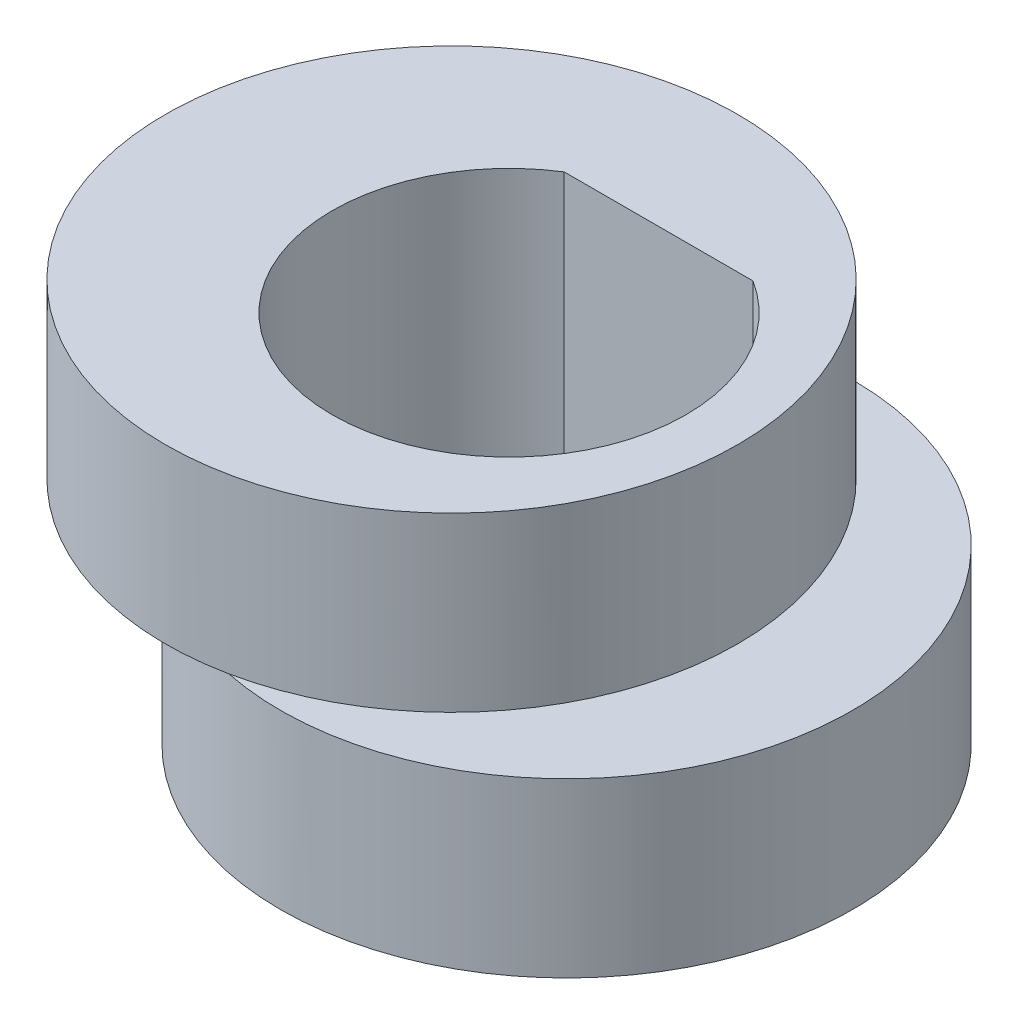
from build123d import *

# Parameters (mm, degrees)
CROQUIS1_R              = 4.975
SALIENTE_EXTRUIR1_DEPTH = 3
CROQUIS2_R              = 4.975
SALIENTE_EXTRUIR2_DEPTH = 3
CORTAR_EXTRUIR1_DEPTH   = 10.820959729


with BuildPart() as part:
    # Croquis1 → Saliente-Extruir1 (new body)
    with BuildSketch(Plane(origin=(0, 0, 0), x_dir=(1, 0, 0), z_dir=(0, 1, 0))):
        with Locations(Location((1, 0, 0), (0, 0, 270))):
            Circle(CROQUIS1_R)
    extrude(amount=SALIENTE_EXTRUIR1_DEPTH)

    # Croquis2 → Saliente-Extruir2 (add)
    with BuildSketch(Plane(origin=(0, 3, 0), x_dir=(1, 0, 0), z_dir=(0, 1, 0))):
        with Locations(Location((-1, 0, 0), (0, 0, 78.404263687))):
            Circle(CROQUIS2_R)
    extrude(amount=SALIENTE_EXTRUIR2_DEPTH)

    # Croquis3 → Cortar-Extruir1 (cut, through all)
    with BuildSketch(Plane(origin=(0, 0, 0), x_dir=(1, 0, 0), z_dir=(0, 1, 0))):
        with BuildLine():
            Line((-1.641835863, 2.6), (1.641835863, 2.6))
            ThreePointArc((1.641835863, 2.6), (0, -3.075), (-1.641835863, 2.6))
        make_face()
    extrude(amount=CORTAR_EXTRUIR1_DEPTH, mode=Mode.SUBTRACT)


solid = part.part
